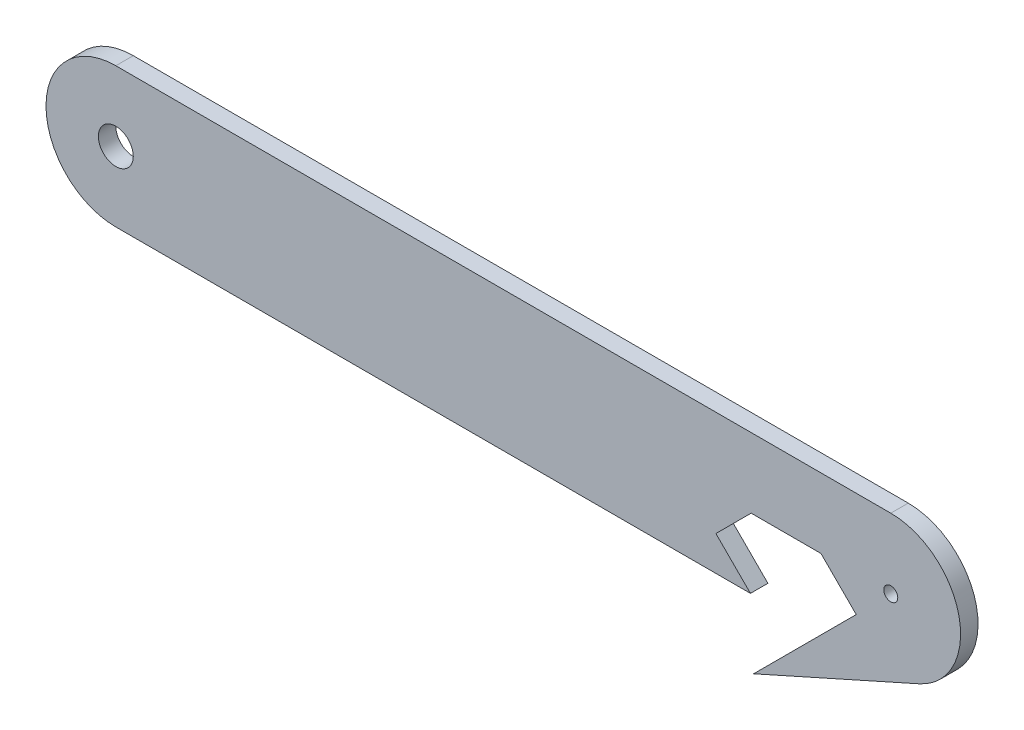
from build123d import *

# Parameters (mm, degrees)
SKETCH1_R           = 3.175
SKETCH1_R_2         = 1.27
BOSS_EXTRUDE1_DEPTH = 3.175


with BuildPart() as part:
    # Sketch1 → Boss-Extrude1 (new body)
    with BuildSketch(Plane.XY):
        with BuildLine():
            Line((115.57, 0), (128.27, 0))
            Line((128.27, 0), (134.683820715, -6.413820715))
            Line((134.683820715, -6.413820715), (116.017803308, -25.079838122))
            Line((116.017803308, -25.079838122), (146.157549282, -11.59220999))
            ThreePointArc((146.157549282, -11.59220999), (153.389965114, 2.652256881), (140.97, 12.7))
            Line((140.97, 12.7), (0, 12.7))
            ThreePointArc((0, 12.7), (-12.7, 0), (0, -12.7))
            Line((0, -12.7), (115.442358569, -12.7))
            Line((115.442358569, -12.7), (109.156179285, -6.413820715))
            Line((109.156179285, -6.413820715), (115.57, 0))
        make_face()
        Circle(SKETCH1_R, mode=Mode.SUBTRACT)
        with Locations((140.97, 0)):
            Circle(SKETCH1_R_2, mode=Mode.SUBTRACT)
    extrude(amount=BOSS_EXTRUDE1_DEPTH)


solid = part.part
